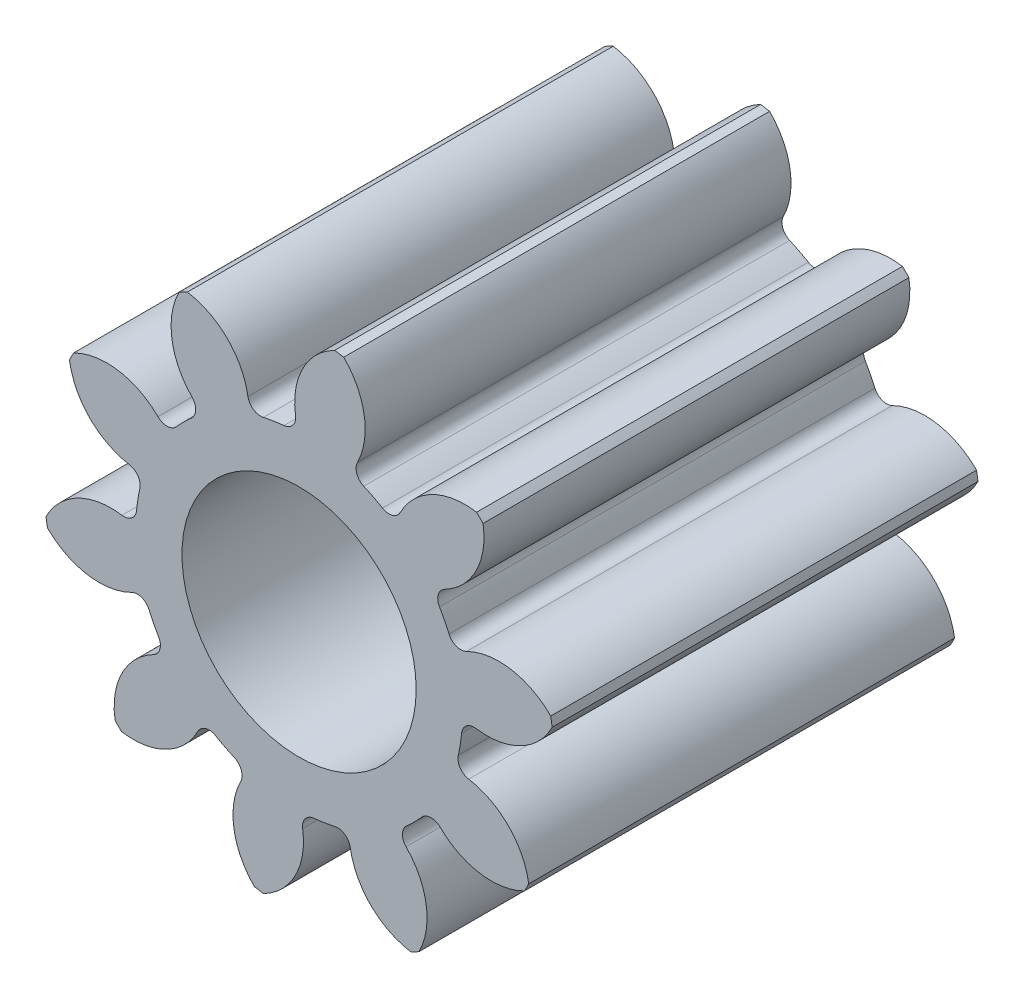
from build123d import *

# Parameters (mm, degrees)
CROQUIS1_R              = 2.75
SALIENTE_EXTRUIR1_DEPTH = 10
REDONDEO1_R             = 0.3
MATRIZC1_COUNT          = 10
REDONDEO1_OF_MATRIZC1_R = 0.3


with BuildPart() as part:
    # Croquis1 → Saliente-Extruir1 (new body)
    with BuildSketch(Plane.XY):
        with BuildLine():
            ThreePointArc((1.048793994, 5.907624832), (0.94248, 5.92551529), (0.835861723, 5.941492673))
            ThreePointArc((0.835861723, 5.941492673), (0.017489827, 5.045982811), (-0.001026119, 3.832999863))
            ThreePointArc((-0.001026119, 3.832999863), (-0.60208764, -3.785416684), (1.190201944, 3.643529653))
            ThreePointArc((1.190201944, 3.643529653), (1.548939794, 4.802398769), (1.048793994, 5.907624832))
        make_face()
        Circle(CROQUIS1_R, mode=Mode.SUBTRACT)
    saliente_extruir1 = extrude(amount=SALIENTE_EXTRUIR1_DEPTH)

    # Redondeo1
    redondeo1_edges = [part.edges().sort_by_distance(p)[0] for p in [
        (-0.001026119, 3.832999863, 5),
        (1.190201944, 3.643529653, 5),
    ]]
    fillet(redondeo1_edges, radius=REDONDEO1_R)

    # MatrizC1: Saliente-Extruir1 ×10 about axis
    matrizc1_axis = Axis((0, 0, 0), (0, 0, 1))
    for i in range(1, MATRIZC1_COUNT):
        add(saliente_extruir1.rotate(matrizc1_axis, i * 360 / MATRIZC1_COUNT))

    # Redondeo1 of MatrizC1
    redondeo1_of_matrizc1_edges = [part.edges().sort_by_distance(p)[0] for p in [
        (-2.253810939, 3.100358891, 5),
        (-1.178719397, 3.647260559, 5),
        (-3.645716584, 1.1834862, 5),
        (-3.097409991, 2.257861897, 5),
        (-3.645082408, -1.185437994, 5),
        (-3.832995246, 0.006036733, 5),
        (-2.252150644, -3.101565166, 5),
        (-3.104506596, -2.248094259, 5),
        (0.001026119, -3.832999863, 5),
        (-1.190201944, -3.643529653, 5),
        (2.253810939, -3.100358891, 5),
        (1.178719397, -3.647260559, 5),
        (3.645716584, -1.1834862, 5),
        (3.097409991, -2.257861897, 5),
        (3.645082408, 1.185437994, 5),
        (3.832995246, -0.006036733, 5),
        (2.252150644, 3.101565166, 5),
        (3.104506596, 2.248094259, 5),
    ]]
    fillet(redondeo1_of_matrizc1_edges, radius=REDONDEO1_OF_MATRIZC1_R)


solid = part.part
